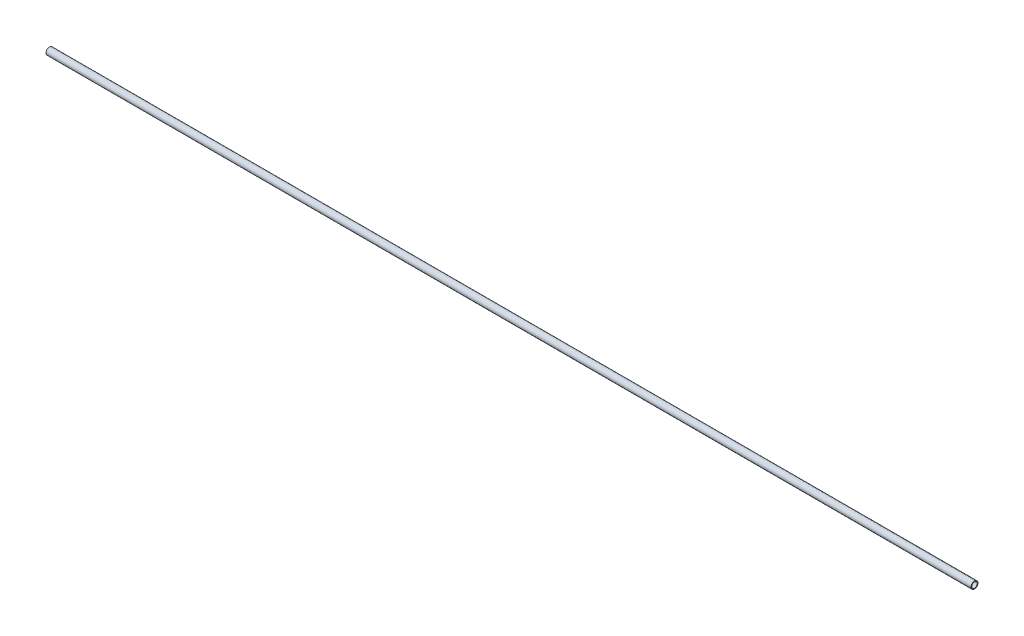
from build123d import *

# Parameters (mm, degrees)
SWEEP_THIN1_PROFILE_R   = 10
SWEEP_THIN1_PROFILE_R_2 = 8


with BuildPart() as part:
    # Sweep-Thin1: sweep along a path in Sketch1
    with BuildLine(Plane.XY) as sweep_thin1_path:
        Line((-179.381625442, -10.66254417), (2480.618374558, -10.66254417))
    # Sweep-Thin1 profile (on start of the path) → Sweep-Thin1 (sweep)
    with BuildSketch(Plane(origin=(-179.381625442, -10.66254417, 0), x_dir=(0, 0, 1), z_dir=(1, 0, 0))):
        Circle(SWEEP_THIN1_PROFILE_R)
        Circle(SWEEP_THIN1_PROFILE_R_2, mode=Mode.SUBTRACT)
    sweep(path=sweep_thin1_path.line)


solid = part.part
